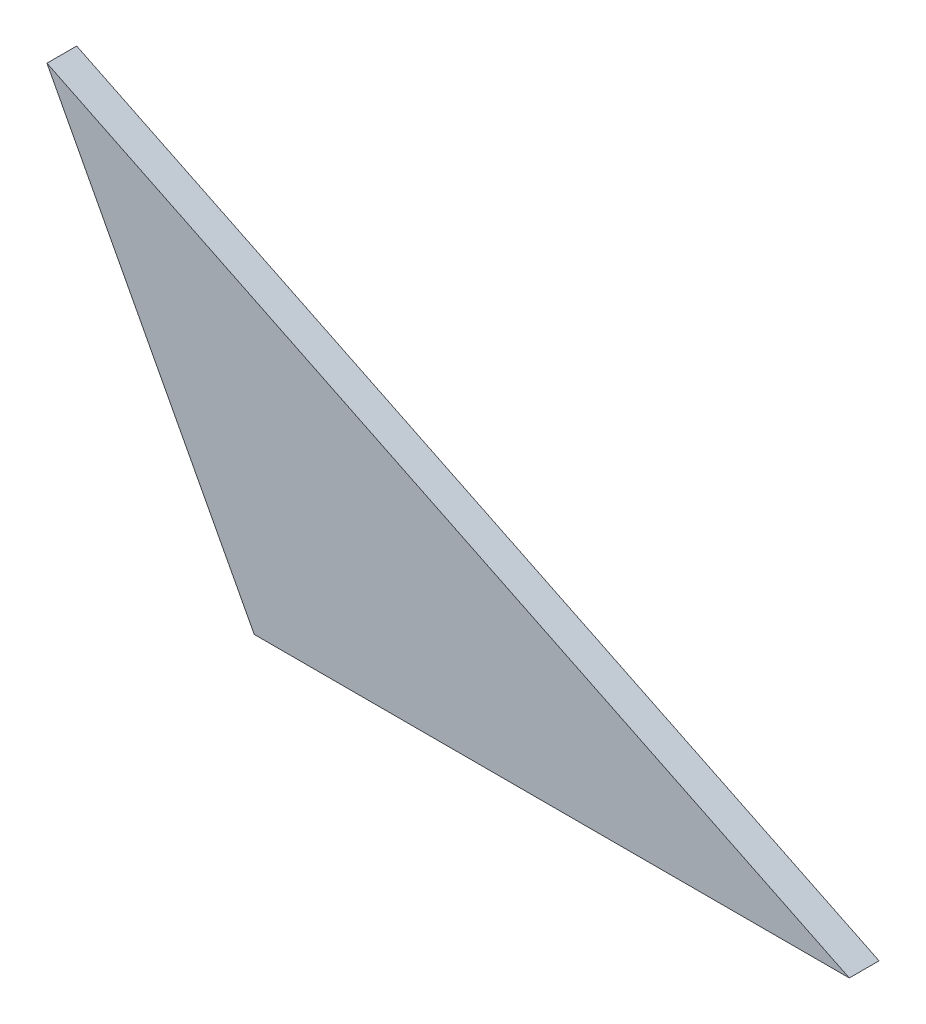
from build123d import *

# Parameters (mm, degrees)
BOSS_EXTRUDE1_DEPTH = 0.01


with BuildPart() as part:
    # Sketch2 → Boss-Extrude1 (new, symmetric)
    with BuildSketch(Plane.XY):
        Polygon((0, 0.177099348), (0.13934959, -0.085773282), (0.53934959, -0.085773282), align=None)
    extrude(amount=BOSS_EXTRUDE1_DEPTH, both=True)


solid = part.part
